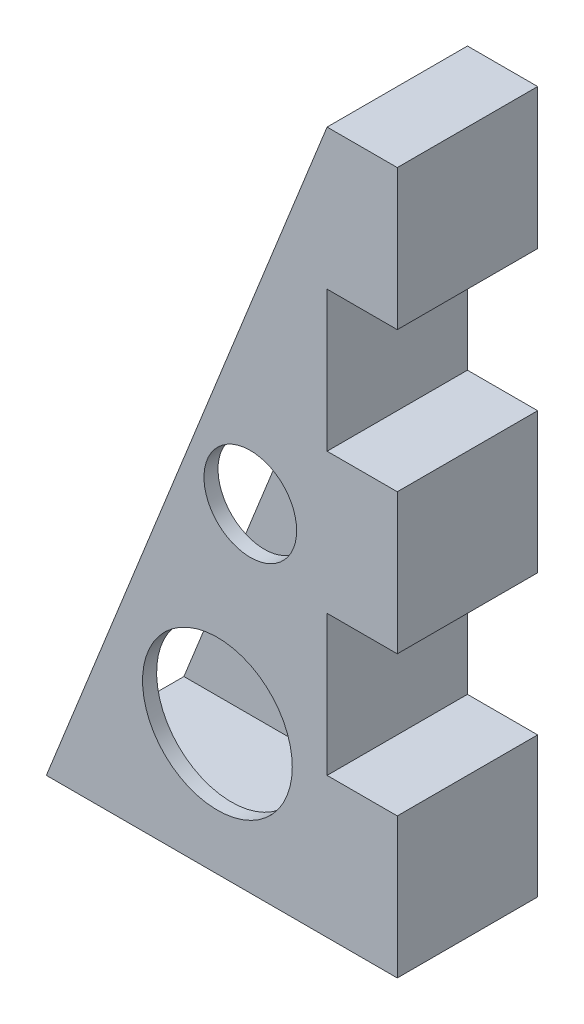
from build123d import *

# Parameters (mm, degrees)
EXTRUDE_1_DEPTH     = 10
CUT_EXTRUDE_START   = 19.214766
SKETCH_3_W          = 8
SKETCH_3_H          = 48
CUT_EXTRUDE_4_DEPTH = 17.2
SKETCH_4_R          = 5.333163539
SKETCH_4_R_2        = 3.300328709
CUT_EXTRUDE_6_DEPTH = 67.968962262


with BuildPart() as part:
    # 草图1 → 凸台-拉伸1 (new body)
    with BuildSketch(Plane.XY):
        Polygon((38.414765995, 50), (18.414765995, 0), (43.414765995, 0), (43.414765995, 10), (38.414765995, 10), (38.414765995, 20), (43.414765995, 20), (43.414765995, 30), (38.414765995, 30), (38.414765995, 40), (43.414765995, 40), (43.414765995, 50), align=None)
    extrude(amount=-EXTRUDE_1_DEPTH)

    # 草图3 → 切除-拉伸4 (cut)
    with BuildSketch(Plane(origin=(0, 0, 0), x_dir=(0, 0, -1), z_dir=(1, 0, 0)).offset(CUT_EXTRUDE_START)):
        with Locations((5, 26)):
            Rectangle(SKETCH_3_W, SKETCH_3_H)
    extrude(amount=CUT_EXTRUDE_4_DEPTH, mode=Mode.SUBTRACT)

    # 草图4 → 切除-拉伸6 (cut, through all)
    with BuildSketch(Plane.XY):
        with Locations((30.601447123, 9.277555354)):
            Circle(SKETCH_4_R)
        with Locations((32.944682438, 24.013712258)):
            Circle(SKETCH_4_R_2)
    extrude(amount=-CUT_EXTRUDE_6_DEPTH, mode=Mode.SUBTRACT)


solid = part.part
